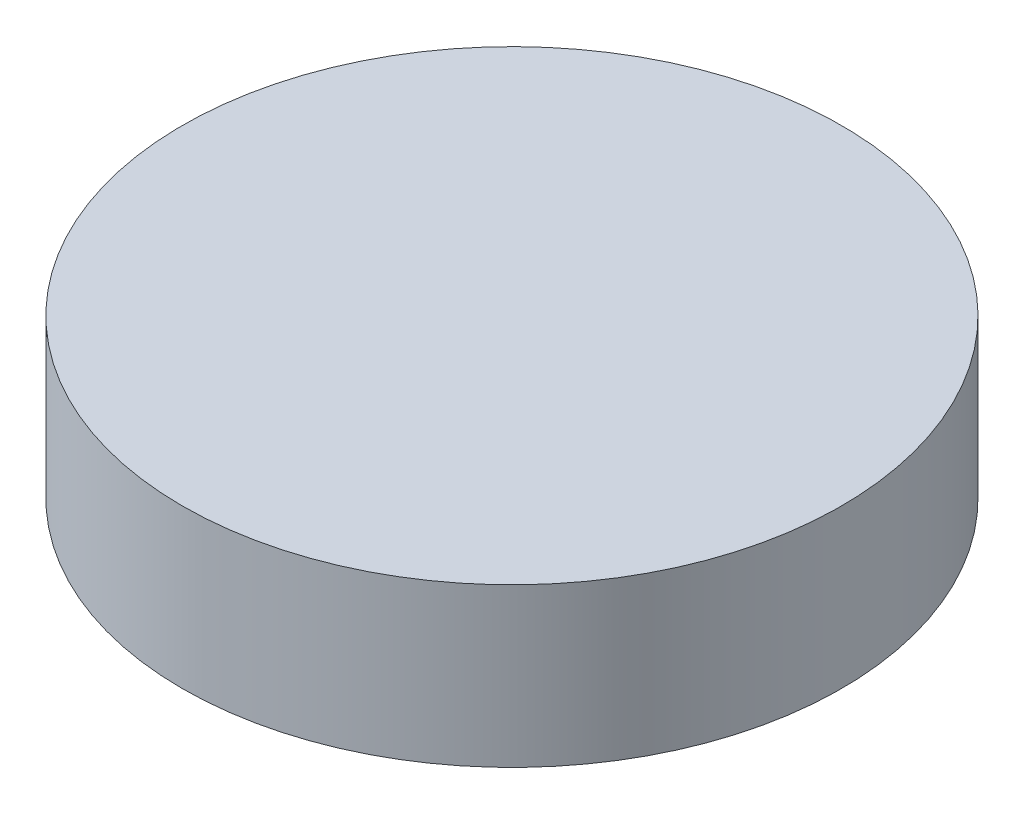
from build123d import *

# Parameters (mm, degrees)
SKETCH1_R               = 25
OVEN_AYAR_AYAGI_4_DEPTH = 12


with BuildPart() as part:
    # Sketch1 → OVEN_ayar_ayagi_4 (new body)
    with BuildSketch(Plane(origin=(0, 0, 0), x_dir=(1, 0, 0), z_dir=(0, 1, 0))):
        with Locations(Location((650, 770, 0), (0, 0, 270))):
            Circle(SKETCH1_R)
    extrude(amount=OVEN_AYAR_AYAGI_4_DEPTH)


solid = part.part
